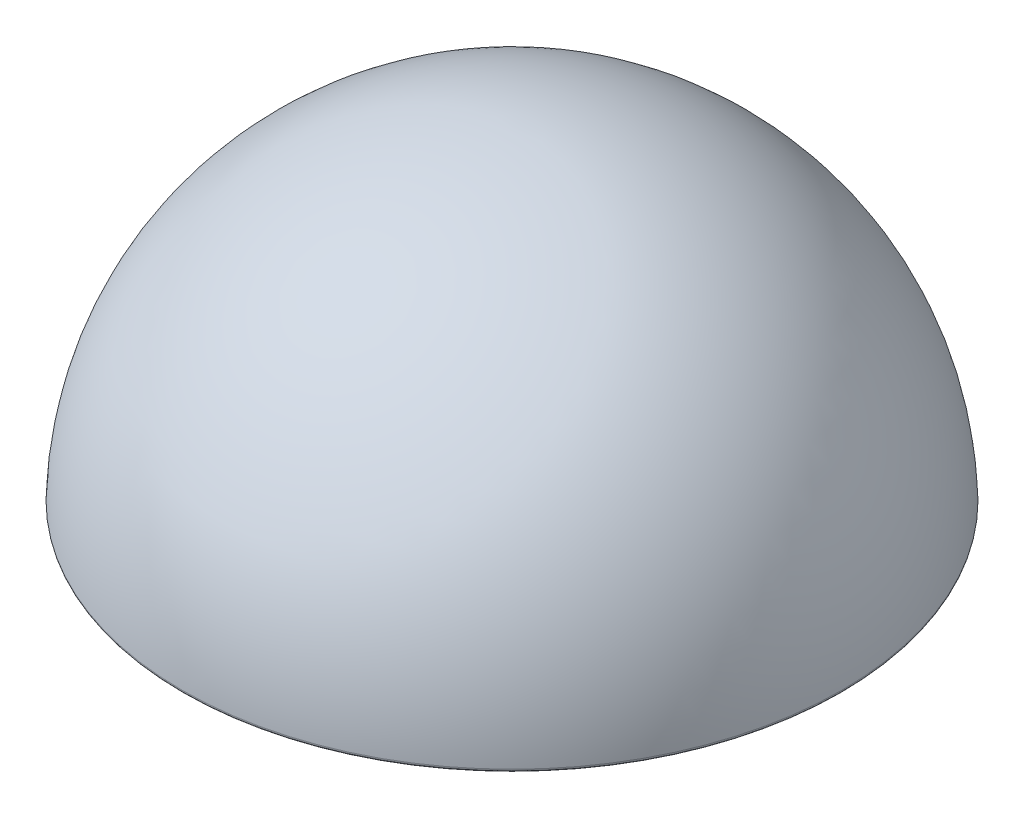
from build123d import *

# Parameters (mm, degrees)
VERRUNDUNG3_R                        = 0.5
AUFSATZ_LINEAR_AUSTRAGEN3_REACH      = 87.912
AUFSATZ_LINEAR_AUSTRAGEN3_END_RADIUS = 47.5
SCHNITT_LINEAR_AUSTRAGEN1_DEPTH      = 5


with BuildPart() as part:
    # Skizze1 → Rotation1 (revolve)
    with BuildSketch(Plane(origin=(0, 0, 0), x_dir=(0, 0, -1), z_dir=(1, 0, 0))):
        with BuildLine():
            Line((0, 50), (0, 31.074955095))
            Line((0, 31.074955095), (17.934534763, 45.133942714))
            ThreePointArc((17.934534763, 45.133942714), (39.421697079, 27.648502112), (47.5, 1.149826685))
            Line((47.5, 1.149826685), (49.986777238, 1.149826685))
            ThreePointArc((49.986777238, 1.149826685), (34.946449503, 35.759553509), (0, 50))
        make_face()
    revolve(axis=Axis((0, -10000, 0), (0, 1, 0)))

    # Verrundung3
    verrundung3_edges = [part.edges().sort_by_distance(p)[0] for p in [
        (0, 1.149826685, 49.986777238),
    ]]
    fillet(verrundung3_edges, radius=VERRUNDUNG3_R)

    # Aufsatz-Linear austragen3: up to this sphere (the profile starts inside it)
    aufsatz_linear_austragen3_end = Location((0, 1.149826685, 0)) * Sphere(AUFSATZ_LINEAR_AUSTRAGEN3_END_RADIUS, mode=Mode.PRIVATE)
    # Skizze3 → Aufsatz-Linear austragen3 (add, up to the surface)
    with BuildSketch(Plane.XZ.offset(-1.149826685), mode=Mode.PRIVATE) as aufsatz_linear_austragen3_sk1:
        with BuildLine():
            ThreePointArc((-2, 2), (-2.707106781, 1.707106781), (-3, 1))
            Line((-3, 1), (-3, -1))
            ThreePointArc((-3, -1), (-2.707106781, -1.707106781), (-2, -2))
            Line((-2, -2), (2, -2))
            ThreePointArc((2, -2), (2.707106781, -1.707106781), (3, -1))
            Line((3, -1), (3, 1))
            ThreePointArc((3, 1), (2.707106781, 1.707106781), (2, 2))
            Line((2, 2), (-2, 2))
        make_face()
    aufsatz_linear_austragen3_tool1 = extrude(aufsatz_linear_austragen3_sk1.sketch, amount=-AUFSATZ_LINEAR_AUSTRAGEN3_REACH, mode=Mode.PRIVATE) & aufsatz_linear_austragen3_end
    add(aufsatz_linear_austragen3_tool1.solids().sort_by_distance((0, 1.149827, 0))[0])

    # Skizze3<4> → Schnitt-Linear austragen1 (cut)
    with BuildSketch(Plane.XZ.offset(-1.149826685)):
        Polygon((-2.25, 0.7), (-2.25, -0.7), (-0.7, -0.7), (-0.7, -2), (0.7, -2), (0.7, -0.7), (2.25, -0.7), (2.25, 0.7), (0.7, 0.7), (0.7, 2), (-0.7, 2), (-0.7, 0.7), align=None)
    extrude(amount=-SCHNITT_LINEAR_AUSTRAGEN1_DEPTH, mode=Mode.SUBTRACT)


solid = part.part
